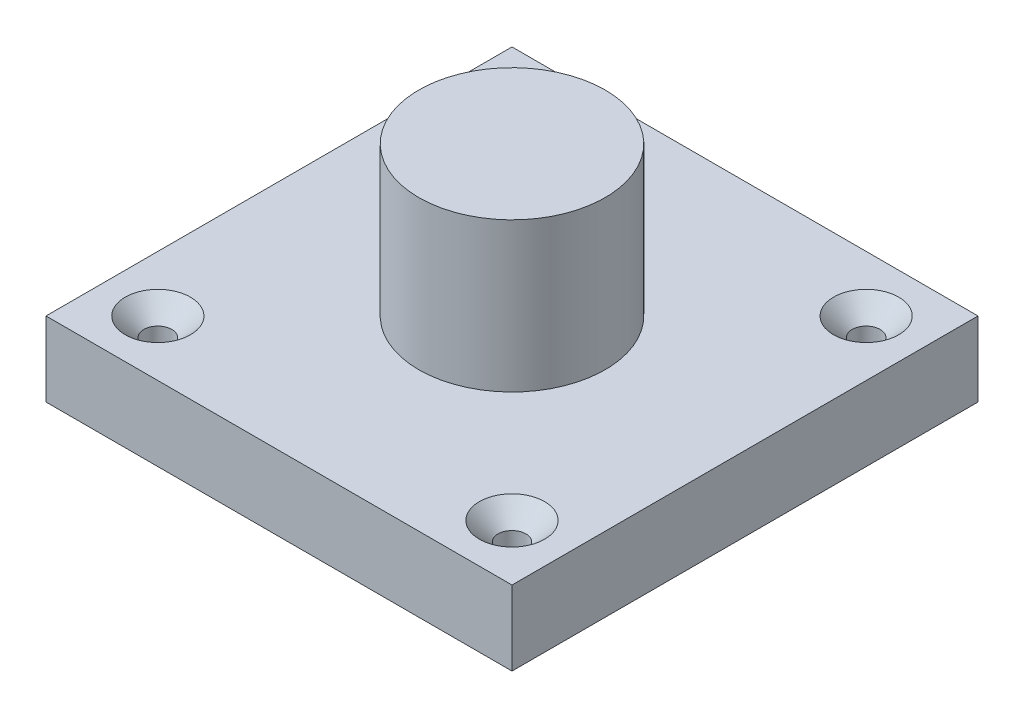
from build123d import *

# Parameters (mm, degrees)
SKETCH1_W                    = 50
SKETCH1_H                    = 50
BOSS_EXTRUDE1_DEPTH          = 8
SKETCH2_R                    = 10
BOSS_EXTRUDE2_DEPTH          = 16
SKETCH3_R                    = 1.5
CUT_EXTRUDE1_DEPTH           = 8
CHAMFER1_SIZE                = 2
CIRPATTERN3_COUNT            = 4
CHAMFER1_OF_CIRPATTERN3_SIZE = 2


with BuildPart() as part:
    # Sketch1 → Boss-Extrude1 (new body)
    with BuildSketch(Plane(origin=(0, 0, 0), x_dir=(1, 0, 0), z_dir=(0, 1, 0))):
        Rectangle(SKETCH1_W, SKETCH1_H)
    extrude(amount=BOSS_EXTRUDE1_DEPTH)

    # Sketch2 → Boss-Extrude2 (add)
    with BuildSketch(Plane(origin=(0, 8, 0), x_dir=(1, 0, 0), z_dir=(0, 1, 0))):
        with Locations(Location((0, 0, 0), (0, 0, 270))):
            Circle(SKETCH2_R)
    extrude(amount=BOSS_EXTRUDE2_DEPTH)

    # Sketch3 → Cut-Extrude1 (cut)
    with BuildSketch(Plane(origin=(0, 8, 0), x_dir=(1, 0, 0), z_dir=(0, 1, 0))):
        with Locations(Location((-19, -19, 0), (0, 0, 270))):
            Circle(SKETCH3_R)
    cut_extrude1 = extrude(amount=-CUT_EXTRUDE1_DEPTH, mode=Mode.SUBTRACT)

    # Chamfer1
    chamfer1_edges = [part.edges().sort_by_distance(p)[0] for p in [
        (-19, 8, 17.5),
    ]]
    chamfer(chamfer1_edges, length=CHAMFER1_SIZE)

    # CirPattern3: Cut-Extrude1 ×4 about axis
    cirpattern3_axis = Axis((0, 0, 0), (0, 1, 0))
    for i in range(1, CIRPATTERN3_COUNT):
        add(cut_extrude1.rotate(cirpattern3_axis, i * 360 / CIRPATTERN3_COUNT), mode=Mode.SUBTRACT)

    # Chamfer1 of CirPattern3
    chamfer1_of_cirpattern3_edges = [part.edges().sort_by_distance(p)[0] for p in [
        (17.5, 8, 19),
        (19, 8, -17.5),
        (-17.5, 8, -19),
    ]]
    chamfer(chamfer1_of_cirpattern3_edges, length=CHAMFER1_OF_CIRPATTERN3_SIZE)


solid = part.part
